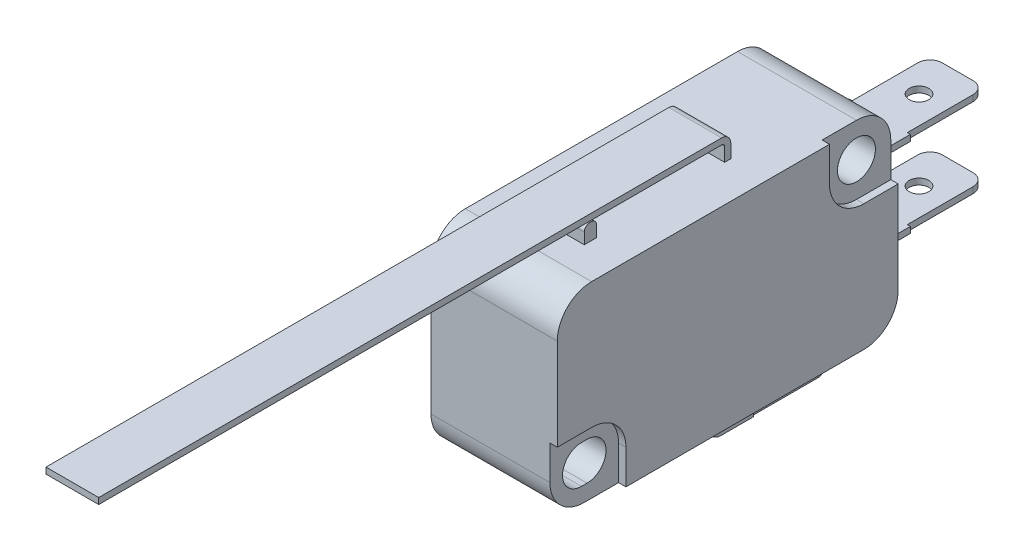
from build123d import *

# Parameters (mm, degrees)
SKETCH1_W           = 27.8
SKETCH1_H           = 15.9
BOSS_EXTRUDE1_DEPTH = 5.15
SKETCH4_R           = 1.55
CUT_EXTRUDE1_DEPTH  = 20.039498418
CUT_EXTRUDE2_DEPTH  = 0.6
SKETCH8_R           = 0.8
BOSS_EXTRUDE2_DEPTH = 0.25
LPATTERN1_COUNT     = 2
LPATTERN1_PITCH     = 6.5
BOSS_EXTRUDE3_DEPTH = 5
SKETCH10_W          = 4.75
SKETCH10_H          = 0.5
BOSS_EXTRUDE4_DEPTH = 6.35
CUT_EXTRUDE3_REACH  = 32.841
SKETCH11_R          = 0.8
BOSS_EXTRUDE5_DEPTH = 2.15
BOSS_EXTRUDE7_DEPTH = 2.25
FILLET1_R           = 2.8
FILLET2_R           = 1


with BuildPart() as part:
    # Sketch1 → Boss-Extrude1 (new, symmetric)
    with BuildSketch(Plane(origin=(0, 0, 0), x_dir=(0, 0, -1), z_dir=(1, 0, 0))):
        Rectangle(SKETCH1_W, SKETCH1_H)
    extrude(amount=BOSS_EXTRUDE1_DEPTH, both=True)

    # Sketch4 → Cut-Extrude1 (cut, through all)
    with BuildSketch(Plane(origin=(5.15, 0, 0), x_dir=(0, 0, -1), z_dir=(1, 0, 0))):
        with Locations((11.1, 5.15)):
            Circle(SKETCH4_R)
        with BuildLine():
            Line((-11.325, -3.6), (-10.875, -3.6))
            ThreePointArc((-10.875, -3.6), (-9.325, -5.15), (-10.875, -6.7))
            Line((-10.875, -6.7), (-11.325, -6.7))
            ThreePointArc((-11.325, -6.7), (-12.875, -5.15), (-11.325, -3.6))
        make_face()
    extrude(amount=-CUT_EXTRUDE1_DEPTH, mode=Mode.SUBTRACT)

    # Sketch5 → Cut-Extrude2 (cut)
    with BuildSketch(Plane(origin=(5.15, 0, 0), x_dir=(0, 0, -1), z_dir=(1, 0, 0))):
        with BuildLine():
            Line((13.9, 2.35), (11.1, 2.35))
            ThreePointArc((11.1, 2.35), (9.120101013, 3.170101013), (8.3, 5.15))
            Line((8.3, 5.15), (8.3, 7.95))
            Line((8.3, 7.95), (13.9, 7.95))
            Line((13.9, 7.95), (13.9, 2.35))
        make_face()
        with BuildLine():
            Line((-13.9, -2.35), (-11.1, -2.35))
            ThreePointArc((-11.1, -2.35), (-9.120101013, -3.170101013), (-8.3, -5.15))
            Line((-8.3, -5.15), (-8.3, -7.95))
            Line((-8.3, -7.95), (-13.9, -7.95))
            Line((-13.9, -7.95), (-13.9, -2.35))
        make_face()
    extrude(amount=-CUT_EXTRUDE2_DEPTH, mode=Mode.SUBTRACT)

    # Sketch8 → Boss-Extrude2 (add, symmetric)
    with BuildSketch(Plane(origin=(0, 2.45, 0), x_dir=(1, 0, 0), z_dir=(0, 1, 0))):
        Polygon((-2.5, 13.9), (2.5, 13.9), (2.5, 17.55), (2.25, 17.55), (2.25, 23.9), (-2.25, 23.9), (-2.25, 17.55), (-2.5, 17.55), align=None)
        with Locations(Location((0, 20.75, 0), (0, 0, 270))):
            Circle(SKETCH8_R, mode=Mode.SUBTRACT)
    boss_extrude2 = extrude(amount=BOSS_EXTRUDE2_DEPTH, both=True)

    # LPattern1: Boss-Extrude2 ×2
    with Locations(*[(0, -i * LPATTERN1_PITCH, 0) for i in range(1, LPATTERN1_COUNT)]):
        add(boss_extrude2)

    # Sketch9 → Boss-Extrude3 (add)
    with BuildSketch(Plane(origin=(2.5, 0, 0), x_dir=(0, 0, -1), z_dir=(1, 0, 0))):
        with BuildLine():
            Line((1.1, -7.95), (1.1, -9.85))
            ThreePointArc((1.1, -9.85), (1.392893219, -10.557106781), (2.1, -10.85))
            Line((2.1, -10.85), (4.75, -10.85))
            Line((4.75, -10.85), (4.75, -10.35))
            Line((4.75, -10.35), (2.1, -10.35))
            ThreePointArc((2.1, -10.35), (1.746446609, -10.203553391), (1.6, -9.85))
            Line((1.6, -9.85), (1.6, -7.95))
            Line((1.6, -7.95), (1.1, -7.95))
        make_face()
    extrude(amount=-BOSS_EXTRUDE3_DEPTH)

    # Sketch10 → Boss-Extrude4 (add)
    with BuildSketch(Plane(origin=(0, 0, -4.75), x_dir=(-1, 0, 0), z_dir=(0, 0, -1))):
        with Locations((0, -10.6)):
            Rectangle(SKETCH10_W, SKETCH10_H)
    extrude(amount=BOSS_EXTRUDE4_DEPTH)

    # Sketch11 → Cut-Extrude3 (cut, up to next)
    with BuildSketch(Plane.XZ.offset(10.85), mode=Mode.PRIVATE) as cut_extrude3_sk1:
        with Locations(Location((0, -7.95, 0), (0, 0, 270))):
            Circle(SKETCH11_R)
    cut_extrude3_tool1 = extrude(cut_extrude3_sk1.sketch, amount=-CUT_EXTRUDE3_REACH, mode=Mode.PRIVATE) & part.part
    add(cut_extrude3_tool1.solids().sort_by_distance((0, -10.85, -7.95))[0], mode=Mode.SUBTRACT)

    # Sketch12 → Boss-Extrude5 (add, symmetric)
    with BuildSketch(Plane(origin=(0, 0, 0), x_dir=(0, 0, -1), z_dir=(1, 0, 0))):
        with BuildLine():
            Line((3.25, 7.95), (3.25, 9.05))
            ThreePointArc((3.25, 9.05), (3.030330086, 9.580330086), (2.5, 9.8))
            Line((2.5, 9.8), (-48.3, 9.8))
            Line((-48.3, 9.8), (-48.3, 9.3))
            Line((-48.3, 9.3), (2.5, 9.3))
            ThreePointArc((2.5, 9.3), (2.676776695, 9.226776695), (2.75, 9.05))
            Line((2.75, 9.05), (2.75, 7.95))
            Line((2.75, 7.95), (3.25, 7.95))
        make_face()
    extrude(amount=BOSS_EXTRUDE5_DEPTH, both=True)

    # Sketch13 → Boss-Extrude7 (add, symmetric)
    with BuildSketch(Plane(origin=(0, 0, 0), x_dir=(0, 0, -1), z_dir=(1, 0, 0))):
        with BuildLine():
            Line((-8.8, 8.85), (-8.8, 7.95))
            Line((-8.8, 7.95), (-7.8, 7.95))
            Line((-7.8, 7.95), (-7.8, 8.85))
            ThreePointArc((-7.8, 8.85), (-7.931801948, 9.168198052), (-8.25, 9.3))
            Line((-8.25, 9.3), (-8.35, 9.3))
            ThreePointArc((-8.35, 9.3), (-8.668198052, 9.168198052), (-8.8, 8.85))
        make_face()
    extrude(amount=BOSS_EXTRUDE7_DEPTH, both=True)

    # Fillet1
    fillet1_edges = [part.edges().sort_by_distance(p)[0] for p in [
        (-0.3, 7.95, -13.9),
        (-0.3, -7.95, 13.9),
        (0, -7.95, -13.9),
        (0, 7.95, 13.9),
    ]]
    fillet(fillet1_edges, radius=FILLET1_R)

    # Fillet2
    fillet2_edges = [part.edges().sort_by_distance(p)[0] for p in [
        (2.375, -10.6, -11.1),
        (-2.375, -10.6, -11.1),
        (2.25, -4.05, -23.9),
        (-2.25, -4.05, -23.9),
        (-2.25, 2.45, -23.9),
        (2.25, 2.45, -23.9),
    ]]
    fillet(fillet2_edges, radius=FILLET2_R)


solid = part.part
